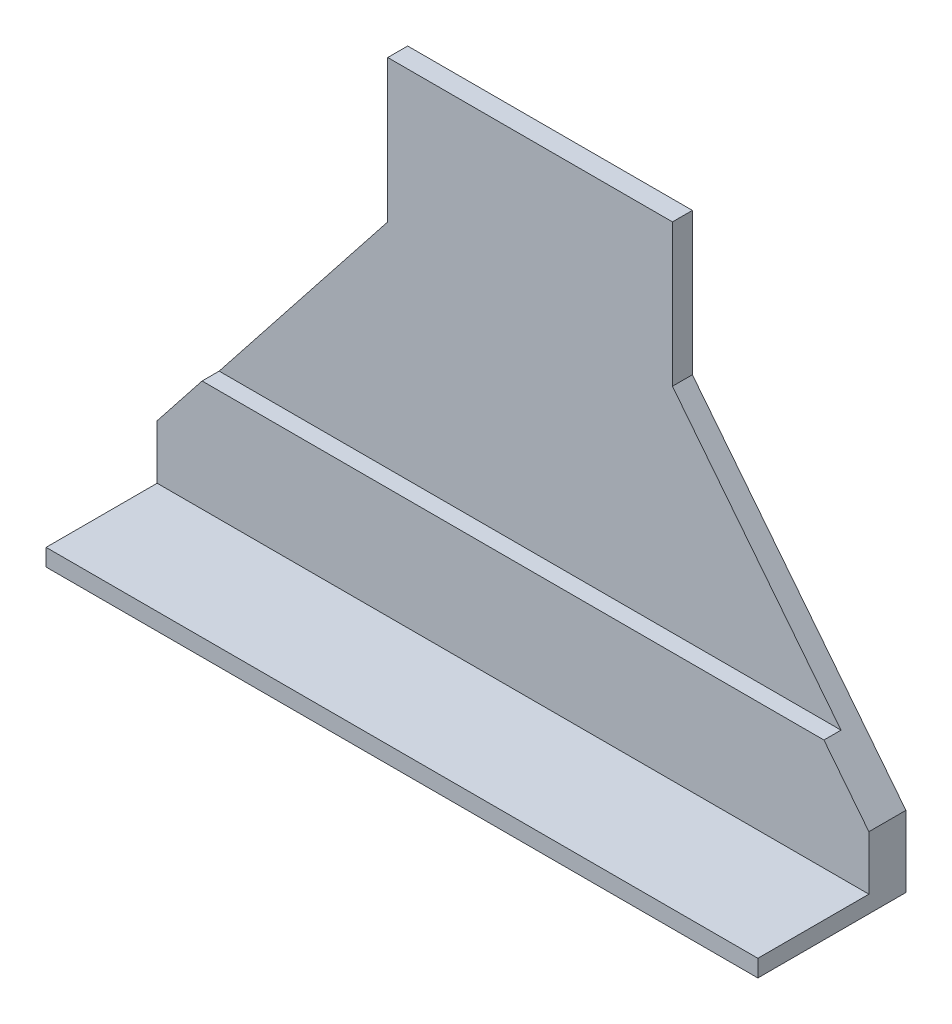
from build123d import *

# Parameters (mm, degrees)
EXTRUDE_1_DEPTH          = 14
SKETCH_3_R               = 13
CUT_EXTRUDE_1_DEPTH      = 423.251110123
PATTERN_LINEAR_1_COUNT   = 3
PATTERN_LINEAR_1_PITCH   = 80
MIRROR_1_COPY_1_SKETCH_R = 13
MIRROR_1_COPY_1_DEPTH    = 423.251110123
MIRROR_1_COPY_2_SKETCH_R = 13
MIRROR_1_COPY_2_DEPTH    = 423.251110123
EXTRUDE_2_DEPTH          = 12
SKETCH_7_R               = 13
CUT_EXTRUDE_2_DEPTH      = 423.819110259
SKETCH_8_W               = 500
SKETCH_8_H               = 12
EXTRUDE_5_DEPTH          = 78
SKETCH_9_R               = 13
CUT_EXTRUDE_3_DEPTH      = 435.644682471
EXTRUDE_6_DEPTH          = 14
EXTRUDE_7_DEPTH          = 26
SKETCH_12_W              = 500
SKETCH_12_H              = 78
EXTRUDE_8_DEPTH          = 12


with BuildPart() as part:
    # 草图1 → 凸台-拉伸1 (new body)
    with BuildSketch(Plane.XY):
        Polygon((0, 0), (250, 0), (250, 50), (100, 240), (100, 340), (0, 340), (-100, 340), (-100, 240), (-250, 50), (-250, 0), align=None)
    extrude(amount=EXTRUDE_1_DEPTH)

    # 草图3 → 切除-拉伸1 (cut, through all)
    with BuildSketch(Plane.XY.offset(14)):
        with Locations((-56, 290)):
            Circle(SKETCH_3_R)
    cut_extrude_1 = extrude(amount=-CUT_EXTRUDE_1_DEPTH, mode=Mode.SUBTRACT)

    # 阵列(线性)1: 切除-拉伸1 ×3
    with Locations(*[(0, -i * PATTERN_LINEAR_1_PITCH, 0) for i in range(1, PATTERN_LINEAR_1_COUNT)]):
        add(cut_extrude_1, mode=Mode.SUBTRACT)

    # 镜向1: 切除-拉伸1 across plane
    add(cut_extrude_1.mirror(Plane(origin=(0, 0, 0), x_dir=(0, 0, 1), z_dir=(1, 0, 0))), mode=Mode.SUBTRACT)

    # 镜向1 copy 1 sketch → 镜向1 copy 1 (cut, through all)
    with BuildSketch(Plane(origin=(0, -80, 14), x_dir=(-1, 0, 0), z_dir=(0, 0, 1))):
        with Locations((-56, -290)):
            Circle(MIRROR_1_COPY_1_SKETCH_R)
    extrude(amount=-MIRROR_1_COPY_1_DEPTH, mode=Mode.SUBTRACT)

    # 镜向1 copy 2 sketch → 镜向1 copy 2 (cut, through all)
    with BuildSketch(Plane(origin=(0, -160, 14), x_dir=(-1, 0, 0), z_dir=(0, 0, 1))):
        with Locations((-56, -290)):
            Circle(MIRROR_1_COPY_2_SKETCH_R)
    extrude(amount=-MIRROR_1_COPY_2_DEPTH, mode=Mode.SUBTRACT)

    # 草图6 → 凸台-拉伸2 (add)
    with BuildSketch(Plane.XY.offset(14)):
        Polygon((218.421052632, 90), (-218.421052632, 90), (-250, 50), (-250, 0), (250, 0), (250, 50), align=None)
    extrude(amount=EXTRUDE_2_DEPTH)

    # 草图7 → 切除-拉伸2 (cut, through all)
    with BuildSketch(Plane.XY.offset(26)):
        with Locations((-56, 50)):
            Circle(SKETCH_7_R)
        with Locations((-130, 50)):
            Circle(SKETCH_7_R)
        with Locations((-196, 50)):
            Circle(SKETCH_7_R)
    cut_extrude_2 = extrude(amount=-CUT_EXTRUDE_2_DEPTH, mode=Mode.SUBTRACT)

    # 镜向2: 切除-拉伸2 across plane
    add(cut_extrude_2.mirror(Plane(origin=(0, 0, 0), x_dir=(0, 0, 1), z_dir=(1, 0, 0))), mode=Mode.SUBTRACT)

    # 草图8 → 凸台-拉伸5 (add)
    with BuildSketch(Plane.XY.offset(26)):
        with Locations((0, 6)):
            Rectangle(SKETCH_8_W, SKETCH_8_H)
    extrude(amount=EXTRUDE_5_DEPTH)

    # 草图9 → 切除-拉伸3 (cut, through all)
    with BuildSketch(Plane.XZ):
        with Locations(Location((-180, 55, 0), (0, 0, 270))):
            Circle(SKETCH_9_R)
        with Locations(Location((-100, 55, 0), (0, 0, 270))):
            Circle(SKETCH_9_R)
    cut_extrude_3 = extrude(amount=-CUT_EXTRUDE_3_DEPTH, mode=Mode.SUBTRACT)

    # 镜向3: 切除-拉伸3 across plane
    add(cut_extrude_3.mirror(Plane(origin=(0, 0, 0), x_dir=(0, 0, 1), z_dir=(1, 0, 0))), mode=Mode.SUBTRACT)

    # 草图10 → 凸台-拉伸6 (add)
    with BuildSketch(Plane.XY.offset(14)):
        Polygon((-100, 340), (100, 340), (100, 240), (218.421052632, 90), (-218.421052632, 90), (-100, 240), align=None)
    extrude(amount=-EXTRUDE_6_DEPTH)

    # 草图11 → 凸台-拉伸7 (add)
    with BuildSketch(Plane.XY.offset(26)):
        Polygon((-218.421052632, 90), (218.421052632, 90), (250, 50), (250, 12), (-250, 12), (-250, 50), align=None)
    extrude(amount=-EXTRUDE_7_DEPTH)

    # 草图12 → 凸台-拉伸8 (add)
    with BuildSketch(Plane(origin=(0, 12, 0), x_dir=(1, 0, 0), z_dir=(0, 1, 0))):
        with Locations((0, -65)):
            Rectangle(SKETCH_12_W, SKETCH_12_H)
    extrude(amount=-EXTRUDE_8_DEPTH)


solid = part.part
